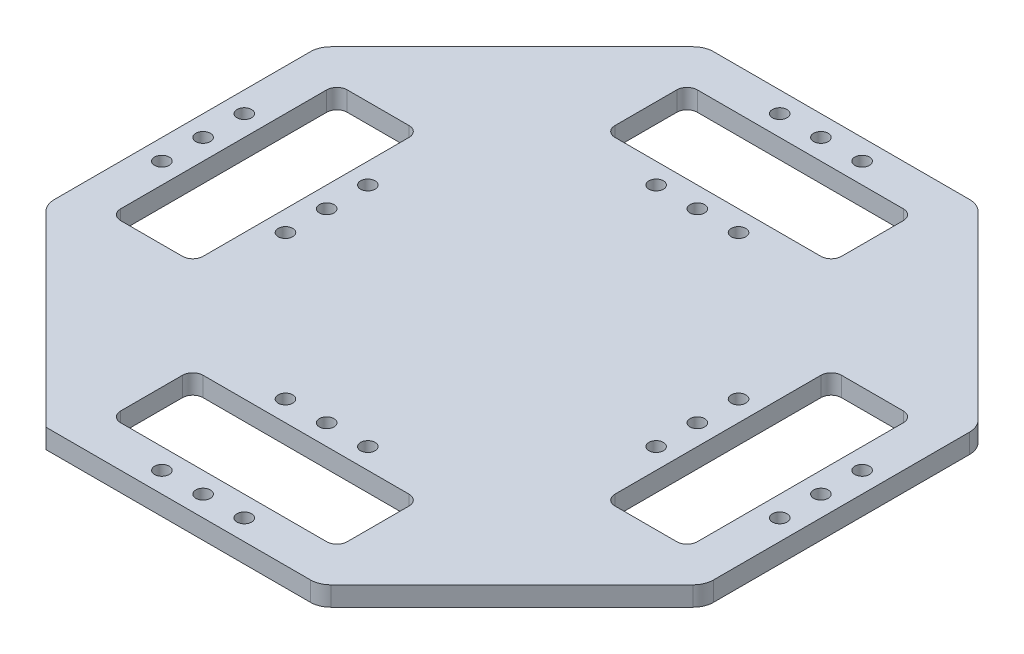
from build123d import *

# Parameters (mm, degrees)
BASE_DEPTH                                 = 5.9944
WHEEL_CUTOUT_REACH                         = 145.809
SKETCH3_W                                  = 69.85
SKETCH3_H                                  = 25.4
WHEEL_CUTOUT_FILLETS_R                     = 3.175
WHEEL_CUTOUT_PATTERN_COUNT                 = 4
WHEEL_CUTOUT_FILLETS_OF_WHEEL_CUTOUT_PAT_R = 3.175
OUTSIDE_FILLETS_R                          = 6.35
F_8_CLEARANCE_HOLE1_D                      = 4.4958
CIRPATTERN2_COUNT                          = 4


with BuildPart() as part:
    # Base sketch → Base (new body)
    with BuildSketch(Plane(origin=(0, 0, 0), x_dir=(1, 0, 0), z_dir=(0, 1, 0))):
        Polygon((-101.6, 42.084097937), (-101.6, -42.084097937), (-42.084097937, -101.6), (42.084097937, -101.6), (101.6, -42.084097937), (101.6, 42.084097937), (42.084097937, 101.6), (-42.084097937, 101.6), align=None)
    extrude(amount=BASE_DEPTH)

    # Sketch3 → Wheel cutout (cut, up to next)
    with BuildSketch(Plane(origin=(0, 5.9944, 0), x_dir=(1, 0, 0), z_dir=(0, 1, 0)), mode=Mode.PRIVATE) as wheel_cutout_sk1:
        with Locations((0, 76.2)):
            Rectangle(SKETCH3_W, SKETCH3_H)
    wheel_cutout_tool1 = extrude(wheel_cutout_sk1.sketch, amount=-WHEEL_CUTOUT_REACH, mode=Mode.PRIVATE) & part.part
    wheel_cutout = wheel_cutout_tool1.solids().sort_by_distance((0, 5.9944, -76.2))[0]
    add(wheel_cutout, mode=Mode.SUBTRACT)

    # Wheel cutout fillets
    wheel_cutout_fillets_edges = [part.edges().sort_by_distance(p)[0] for p in [
        (-34.925, 2.9972, -63.5),
        (-34.925, 2.9972, -88.9),
        (34.925, 2.9972, -88.9),
        (34.925, 2.9972, -63.5),
    ]]
    fillet(wheel_cutout_fillets_edges, radius=WHEEL_CUTOUT_FILLETS_R)

    # Wheel cutout pattern: Wheel cutout ×4 about axis
    wheel_cutout_pattern_axis = Axis((0, 0, 0), (0, 1, 0))
    for i in range(1, WHEEL_CUTOUT_PATTERN_COUNT):
        add(wheel_cutout.rotate(wheel_cutout_pattern_axis, i * 360 / WHEEL_CUTOUT_PATTERN_COUNT), mode=Mode.SUBTRACT)

    # Wheel cutout fillets of Wheel cutout pat
    wheel_cutout_fillets_of_wheel_cutout_pat_edges = [part.edges().sort_by_distance(p)[0] for p in [
        (-63.5, 2.9972, 34.925),
        (-88.9, 2.9972, 34.925),
        (-88.9, 2.9972, -34.925),
        (-63.5, 2.9972, -34.925),
        (34.925, 2.9972, 63.5),
        (34.925, 2.9972, 88.9),
        (-34.925, 2.9972, 88.9),
        (-34.925, 2.9972, 63.5),
        (63.5, 2.9972, -34.925),
        (88.9, 2.9972, -34.925),
        (88.9, 2.9972, 34.925),
        (63.5, 2.9972, 34.925),
    ]]
    fillet(wheel_cutout_fillets_of_wheel_cutout_pat_edges, radius=WHEEL_CUTOUT_FILLETS_OF_WHEEL_CUTOUT_PAT_R)

    # Outside fillets
    outside_fillets_edges = [part.edges().sort_by_distance(p)[0] for p in [
        (-42.084097937, 2.9972, -101.6),
        (42.084097937, 2.9972, -101.6),
        (101.6, 2.9972, -42.084097937),
        (101.6, 2.9972, 42.084097937),
        (42.084097937, 2.9972, 101.6),
        (-101.6, 2.9972, 42.084097937),
        (-101.6, 2.9972, -42.084097937),
    ]]
    fillet(outside_fillets_edges, radius=OUTSIDE_FILLETS_R)

    # #8 Clearance Hole1 (through all)
    with Locations(Plane(origin=(0, 5.9944, 0), x_dir=(1, 0, 0), z_dir=(0, 1, 0))):
        with Locations((0, 95.25), (-12.7, 95.25), (12.7, 95.25), (12.7, 57.15), (-12.7, 57.15), (0, 57.15)):
            f_8_clearance_hole1 = Hole(F_8_CLEARANCE_HOLE1_D / 2)

    # CirPattern2: #8 Clearance Hole1 ×4 about axis
    cirpattern2_axis = Axis((0, 0, 0), (0, 1, 0))
    for i in range(1, CIRPATTERN2_COUNT):
        add(f_8_clearance_hole1.rotate(cirpattern2_axis, i * 360 / CIRPATTERN2_COUNT), mode=Mode.SUBTRACT)


solid = part.part
